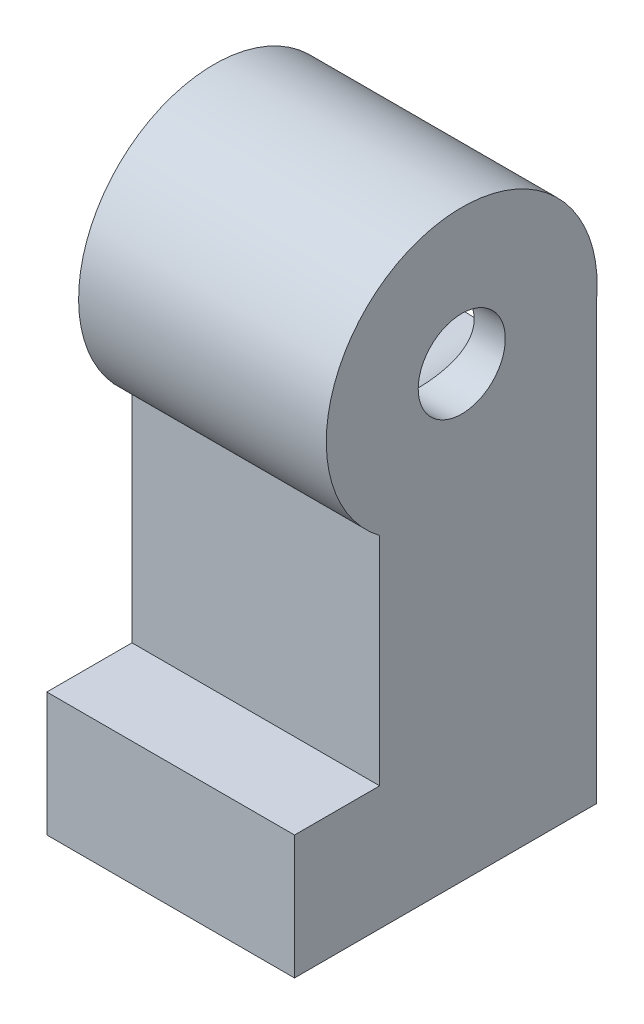
from build123d import *

# Parameters (mm, degrees)
BOSS_EXTRUDE1_DEPTH = 6.4
SKETCH2_R           = 1.125
CUT_EXTRUDE1_DEPTH  = 2
SKETCH4_R           = 2.4
CUT_EXTRUDE3_DEPTH  = 5
SKETCH5_W           = 4.8
SKETCH5_H           = 3.3
CUT_EXTRUDE4_DEPTH  = 8.9


with BuildPart() as part:
    # Sketch1 → Boss-Extrude1 (new body)
    with BuildSketch(Plane(origin=(0, 0, 0), x_dir=(0, 0, -1), z_dir=(1, 0, 0))):
        with BuildLine():
            Line((0, 0), (7.8, 0))
            Line((7.8, 0), (7.8, 3.2))
            Line((7.8, 3.2), (5.6, 3.2))
            Line((5.6, 3.2), (5.6, 8.8))
            ThreePointArc((5.6, 8.8), (4.857585772, 14.801033467), (0, 11.2))
            Line((0, 11.2), (0, 0))
        make_face()
    extrude(amount=BOSS_EXTRUDE1_DEPTH)

    # Sketch2 → Cut-Extrude1 (cut)
    with BuildSketch(Plane(origin=(6.4, 0, 0), x_dir=(0, 0, -1), z_dir=(1, 0, 0))):
        with Locations((3.478868227, 11.584025862)):
            Circle(SKETCH2_R)
    extrude(amount=-CUT_EXTRUDE1_DEPTH, mode=Mode.SUBTRACT)

    # Sketch4 → Cut-Extrude3 (cut, symmetric)
    with BuildSketch(Plane.XY):
        with Locations((3.2, 11.7)):
            Circle(SKETCH4_R)
    extrude(amount=CUT_EXTRUDE3_DEPTH, both=True, mode=Mode.SUBTRACT)

    # Sketch5 → Cut-Extrude4 (cut)
    with BuildSketch(Plane.XZ):
        with Locations((3.2, -3.05)):
            Rectangle(SKETCH5_W, SKETCH5_H)
    extrude(amount=-CUT_EXTRUDE4_DEPTH, mode=Mode.SUBTRACT)


with BuildPart() as body_2:
    # Mirror4: mirrored copy
    add(part.part.mirror(Plane.XY.offset(10)))


solid = body_2.part
